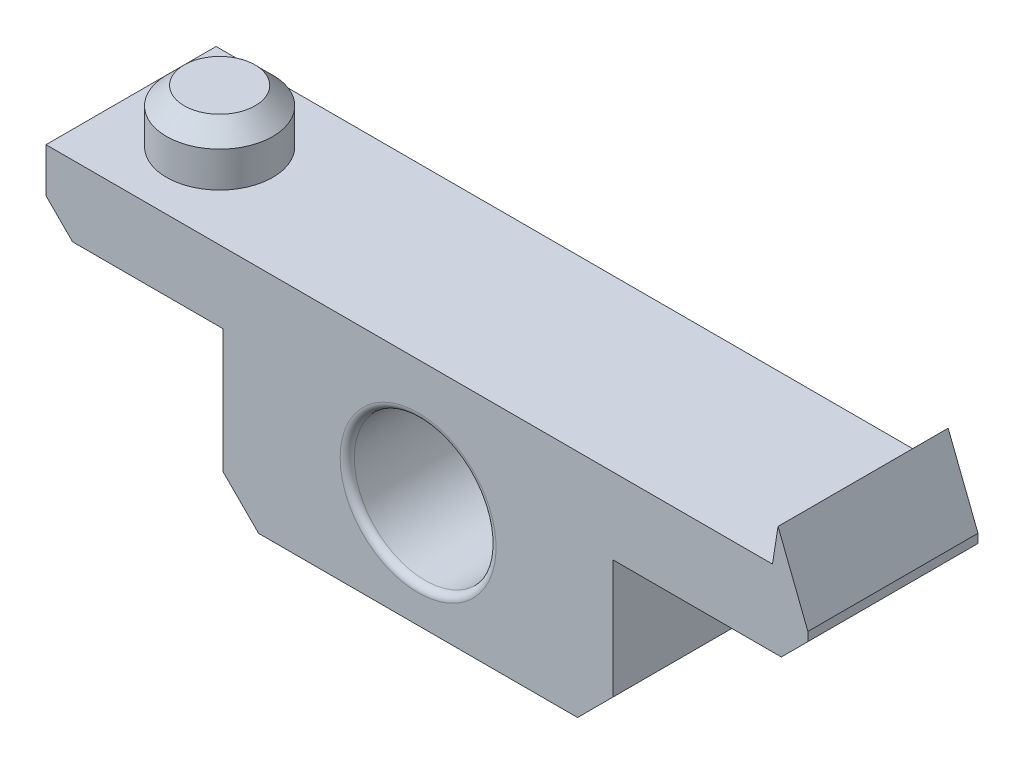
from build123d import *

# Parameters (mm, degrees)
EXTRUDE_1_DEPTH     = 4.8
SKETCH_2_R          = 2
CUT_EXTRUDE_1_DEPTH = 10
CHAMFER_1_SIZE      = 1
CHAMFER_2_SIZE      = 0.75
SKETCH_3_R          = 1.5
EXTRUDE_2_DEPTH     = 1.5
CHAMFER_3_SIZE      = 0.5
FILLET_2_R          = 0.2


with BuildPart() as part:
    # 스케치1 → 보스-돌출1 (new body)
    with BuildSketch(Plane.XY):
        Polygon((0, 0), (20.5, 0), (20.657326787, 1), (21.5, -1.146107212), (21.5, -2.146107212), (16, -2.146107212), (16, -6.5), (5, -6.5), (5, -2), (0, -2), align=None)
    extrude(amount=EXTRUDE_1_DEPTH)

    # 스케치2 → 컷-돌출1 (cut)
    with BuildSketch(Plane.XY.offset(4.8)):
        with Locations((10.5, -3.5)):
            Circle(SKETCH_2_R)
    extrude(amount=-CUT_EXTRUDE_1_DEPTH, mode=Mode.SUBTRACT)

    # 모따기1
    chamfer_1_edges = [part.edges().sort_by_distance(p)[0] for p in [
        (16, -6.5, 2.4),
        (5, -6.5, 2.4),
    ]]
    chamfer(chamfer_1_edges, length=CHAMFER_1_SIZE)

    # 모따기2
    chamfer_2_edges = [part.edges().sort_by_distance(p)[0] for p in [
        (21.5, -2.146107212, 2.4),
        (0, -2, 2.4),
    ]]
    chamfer(chamfer_2_edges, length=CHAMFER_2_SIZE)

    # 스케치3 → 보스-돌출2 (add)
    with BuildSketch(Plane(origin=(0, 0, 0), x_dir=(1, 0, 0), z_dir=(0, 1, 0))):
        with Locations(Location((2.5, -2.4, 0), (0, 0, 90))):
            Circle(SKETCH_3_R)
    extrude(amount=EXTRUDE_2_DEPTH)

    # 모따기3
    chamfer_3_edges = [part.edges().sort_by_distance(p)[0] for p in [
        (2.5, 1.5, 3.9),
    ]]
    chamfer(chamfer_3_edges, length=CHAMFER_3_SIZE)

    # 필렛2
    fillet_2_edges = [part.edges().sort_by_distance(p)[0] for p in [
        (8.5, -3.5, 0),
        (8.5, -3.5, 4.8),
    ]]
    fillet(fillet_2_edges, radius=FILLET_2_R)


solid = part.part
